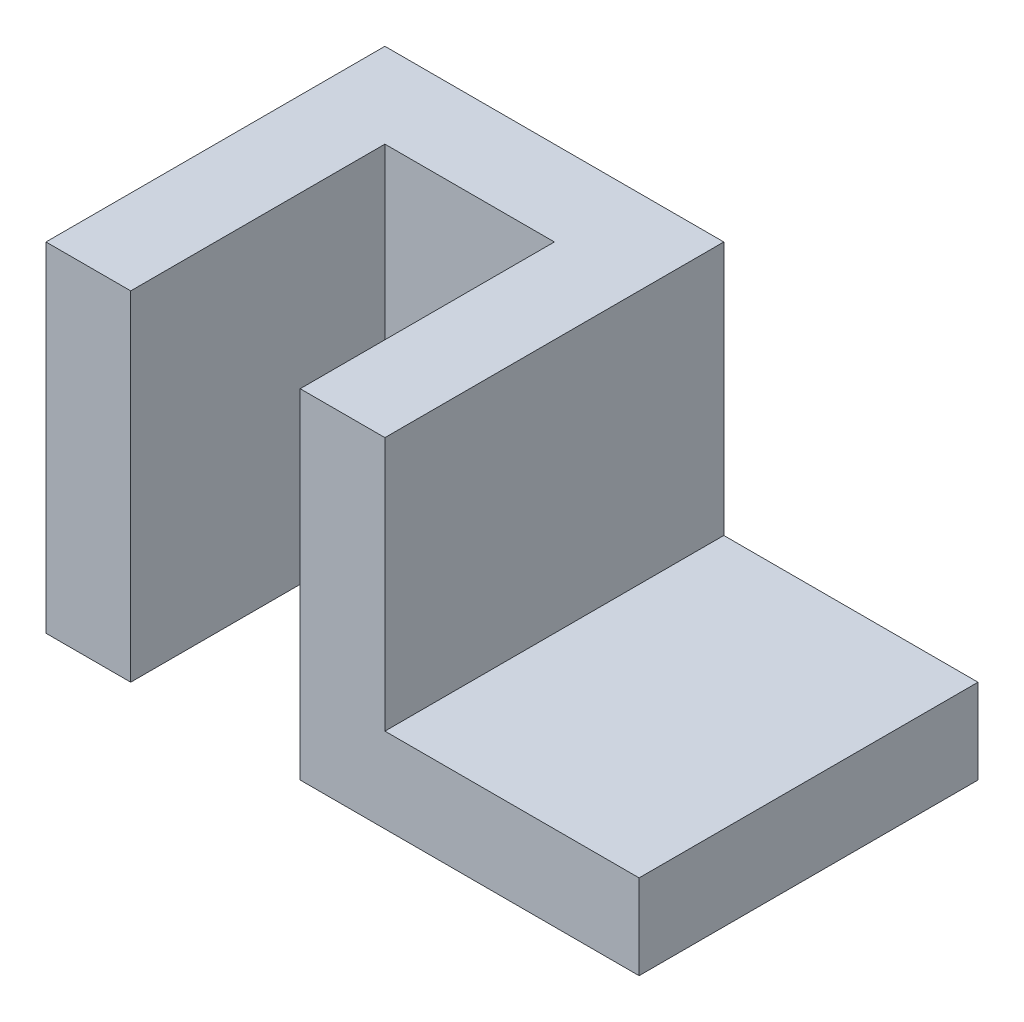
from build123d import *

# Parameters (mm, degrees)
BOSS_EXTRUDE1_DEPTH = 40
SKETCH2_W           = 40
SKETCH2_H           = 10
BOSS_EXTRUDE2_DEPTH = 30


with BuildPart() as part:
    # Sketch1 → Boss-Extrude1 (new body)
    with BuildSketch(Plane(origin=(0, 0, 0), x_dir=(1, 0, 0), z_dir=(0, 1, 0))):
        Polygon((0, 0), (0, 40), (40, 40), (40, 0), (30, 0), (30, 30), (10, 30), (10, 0), align=None)
    extrude(amount=BOSS_EXTRUDE1_DEPTH)

    # Sketch2 → Boss-Extrude2 (add)
    with BuildSketch(Plane(origin=(40, 0, 0), x_dir=(0, 0, -1), z_dir=(1, 0, 0))):
        with Locations((20, 5)):
            Rectangle(SKETCH2_W, SKETCH2_H)
    extrude(amount=BOSS_EXTRUDE2_DEPTH)


solid = part.part
